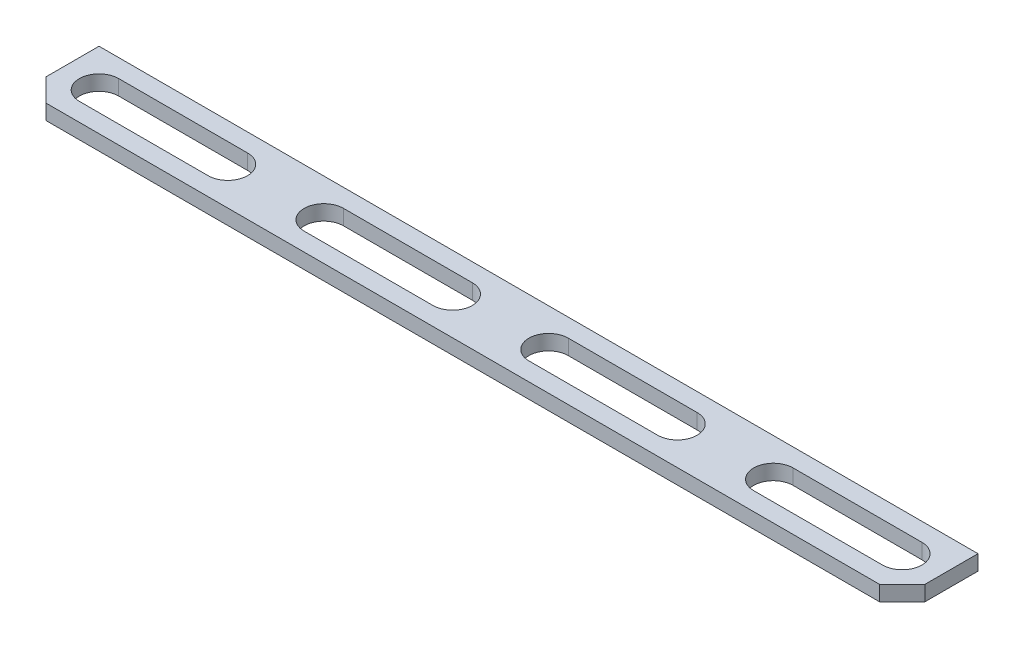
from build123d import *

# Parameters (mm, degrees)
SKETCH_1_W          = 116
SKETCH_1_H          = 10
EXTRUDE_1_DEPTH     = 2
CUT_EXTRUDE_1_DEPTH = 10
CHAMFER_1_SIZE      = 3


with BuildPart() as part:
    # 스케치1 → 보스-돌출1 (new body)
    with BuildSketch(Plane(origin=(0, 0, 0), x_dir=(1, 0, 0), z_dir=(0, 1, 0))):
        with Locations((58, 5)):
            Rectangle(SKETCH_1_W, SKETCH_1_H)
    extrude(amount=EXTRUDE_1_DEPTH)

    # 스케치2 → 컷-돌출1 (cut)
    with BuildSketch(Plane(origin=(0, 2, 0), x_dir=(1, 0, 0), z_dir=(0, 1, 0))):
        with BuildLine():
            Line((5, 7.6), (22, 7.6))
            ThreePointArc((22, 7.6), (24.6, 5), (22, 2.4))
            Line((22, 2.4), (5, 2.4))
            ThreePointArc((5, 2.4), (2.4, 5), (5, 7.6))
        make_face()
        with BuildLine():
            Line((34.666666667, 7.6), (51.666666667, 7.6))
            ThreePointArc((51.666666667, 7.6), (54.266666667, 5), (51.666666667, 2.4))
            Line((51.666666667, 2.4), (34.666666667, 2.4))
            ThreePointArc((34.666666667, 2.4), (32.066666667, 5), (34.666666667, 7.6))
        make_face()
        with BuildLine():
            Line((64.333333333, 7.6), (81.333333333, 7.6))
            ThreePointArc((81.333333333, 7.6), (83.933333333, 5), (81.333333333, 2.4))
            Line((81.333333333, 2.4), (64.333333333, 2.4))
            ThreePointArc((64.333333333, 2.4), (61.733333333, 5), (64.333333333, 7.6))
        make_face()
        with BuildLine():
            Line((94, 7.6), (111, 7.6))
            ThreePointArc((111, 7.6), (113.6, 5), (111, 2.4))
            Line((111, 2.4), (94, 2.4))
            ThreePointArc((94, 2.4), (91.4, 5), (94, 7.6))
        make_face()
    extrude(amount=-CUT_EXTRUDE_1_DEPTH, mode=Mode.SUBTRACT)

    # 모따기1
    chamfer_1_edges = [part.edges().sort_by_distance(p)[0] for p in [
        (116, 1, 0),
        (0, 1, 0),
    ]]
    chamfer(chamfer_1_edges, length=CHAMFER_1_SIZE)


solid = part.part
